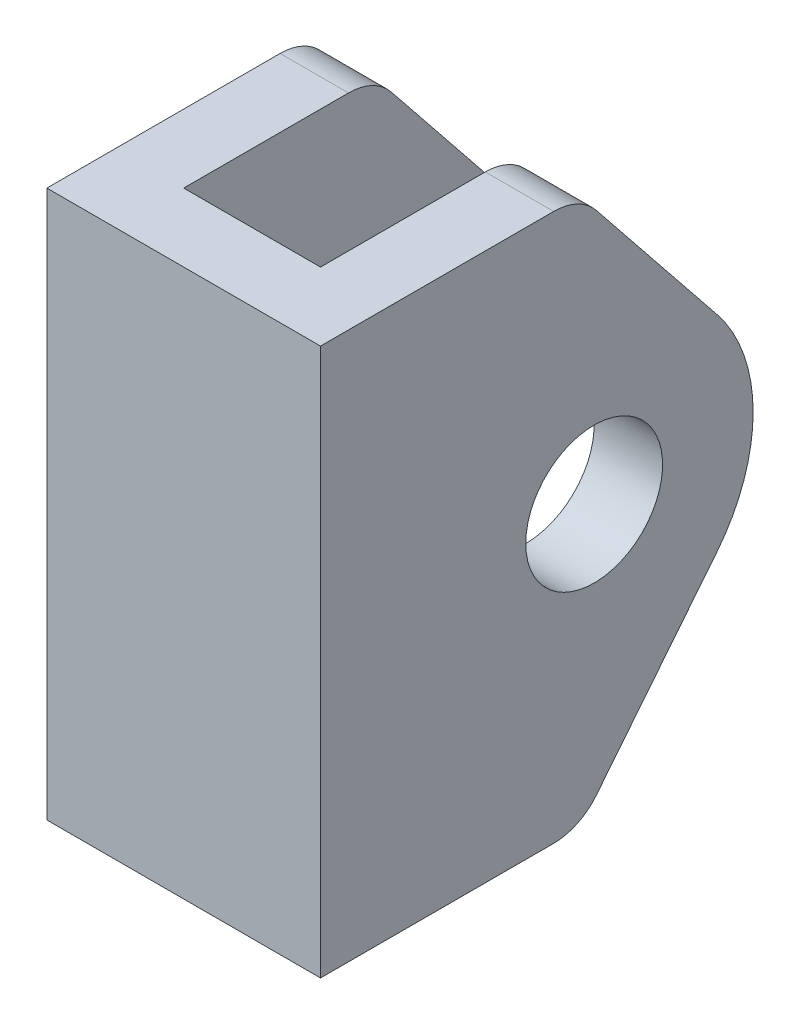
from build123d import *

# Parameters (mm, degrees)
BOSS_EXTRUDE1_DEPTH      = 12.7
BOSS_EXTRUDE1_DEPTH_BACK = 12.7
SKETCH3_R                = 3.175
CUT_EXTRUDE1_DEPTH       = 27.549927447
CUT_EXTRUDE3_DEPTH       = 17.78
FILLET1_R                = 7.62
FILLET2_R                = 2.54


with BuildPart() as part:
    # Sketch1 → Boss-Extrude1 (new, two sides: drawn at the far end of the back side and taken through both)
    with BuildSketch(Plane(origin=(0, 0, 0), x_dir=(1, 0, 0), z_dir=(0, 1, 0)).offset(-BOSS_EXTRUDE1_DEPTH_BACK)):
        Polygon((-21.470544554, -2.672029703), (-8.770544554, -2.672029703), (-8.770544554, 19.552970297), (-11.945544554, 19.552970297), (-11.945544554, 0.502970297), (-18.295544554, 0.502970297), (-18.295544554, 19.552970297), (-21.470544554, 19.552970297), align=None)
    extrude(amount=BOSS_EXTRUDE1_DEPTH + BOSS_EXTRUDE1_DEPTH_BACK)

    # Sketch3 → Cut-Extrude1 (cut, through all)
    with BuildSketch(Plane.ZY.offset(21.470544554)):
        with Locations((-10.027970297, 0)):
            Circle(SKETCH3_R)
    extrude(amount=-CUT_EXTRUDE1_DEPTH, mode=Mode.SUBTRACT)

    # Sketch5 → Cut-Extrude3 (cut)
    with BuildSketch(Plane(origin=(-8.770544554, 0, 0), x_dir=(0, 0, -1), z_dir=(1, 0, 0))):
        Polygon((19.552970297, 12.7), (9.369494421, 12.7), (19.552970297, 0), align=None)
        Polygon((19.552970297, -12.7), (19.552970297, 0), (9.369494421, -12.7), align=None)
    extrude(amount=-CUT_EXTRUDE3_DEPTH, mode=Mode.SUBTRACT)

    # Fillet1
    fillet1_edges = [part.edges().sort_by_distance(p)[0] for p in [
        (-19.883044554, 0, -19.552970297),
        (-10.358044554, 0, -19.552970297),
    ]]
    fillet(fillet1_edges, radius=FILLET1_R)

    # Fillet2
    fillet2_edges = [part.edges().sort_by_distance(p)[0] for p in [
        (-19.883044554, -12.7, -9.369494421),
        (-10.358044554, -12.7, -9.369494421),
        (-10.358044554, 12.7, -9.369494421),
        (-19.883044554, 12.7, -9.369494421),
    ]]
    fillet(fillet2_edges, radius=FILLET2_R)


solid = part.part
